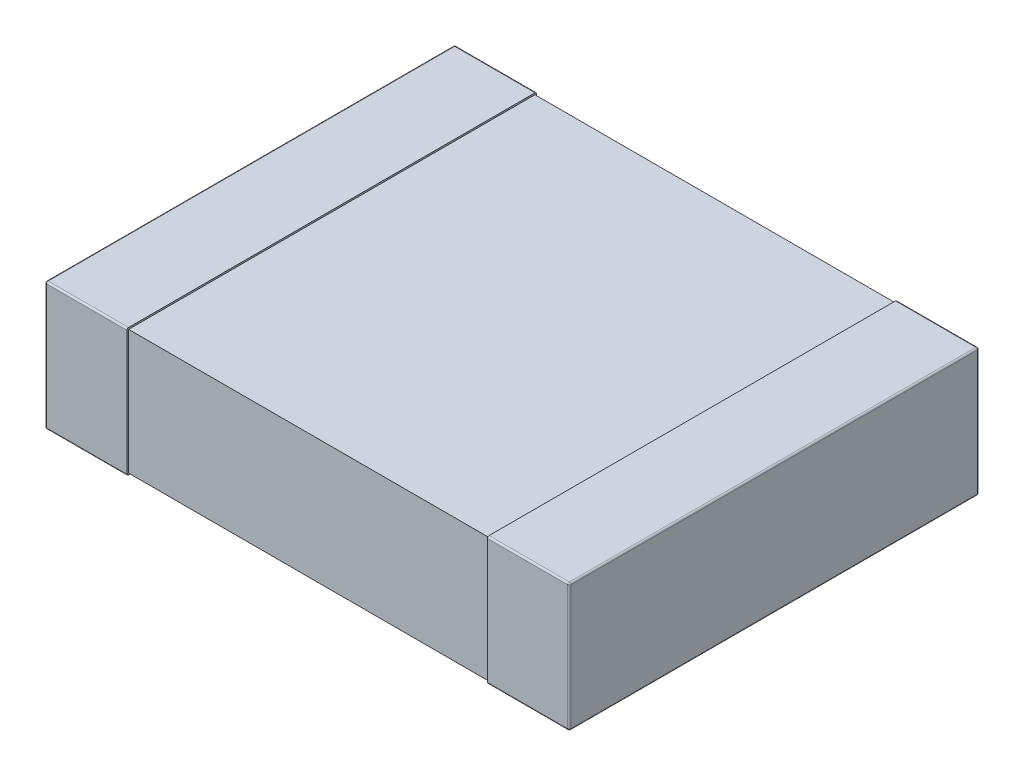
from build123d import *

# Parameters (mm, degrees)
SKETCH1_W            = 0.5
SKETCH1_H            = 2.5
THICKNESS_DEPTH      = 0.39
FILLET1_R            = 0.01
SKETCH2_W            = 2.48
SKETCH2_H            = 0.76
BOSS_EXTRUDE2_DEPTH  = 1.1
FILLET1_OF_MIRROR3_R = 0.01


with BuildPart() as part:
    # Sketch1 → THICKNESS (new, symmetric)
    with BuildSketch(Plane(origin=(0, 0, 0), x_dir=(1, 0, 0), z_dir=(0, 1, 0))):
        with Locations((-1.35, 0)):
            Rectangle(SKETCH1_W, SKETCH1_H)
    thickness = extrude(amount=THICKNESS_DEPTH, both=True)

    # Fillet1
    fillet1_edges = [part.edges().sort_by_distance(p)[0] for p in [
        (-1.35, 0.39, -1.25),
        (-1.6, 0.39, 0),
        (-1.35, -0.39, -1.25),
        (-1.35, -0.39, 1.25),
        (-1.6, -0.39, 0),
        (-1.35, 0.39, 1.25),
        (-1.6, 0, -1.25),
        (-1.6, 0, 1.25),
    ]]
    fillet(fillet1_edges, radius=FILLET1_R)

    # Sketch2 → Boss-Extrude2 (add)
    with BuildSketch(Plane(origin=(0, 0, 0), x_dir=(0, 0, -1), z_dir=(1, 0, 0))):
        Rectangle(SKETCH2_W, SKETCH2_H)
    boss_extrude2 = extrude(amount=-BOSS_EXTRUDE2_DEPTH)

    # Mirror3: THICKNESS, Boss-Extrude2 across plane
    add(thickness.mirror(Plane(origin=(0, 0, 0), x_dir=(0, 0, 1), z_dir=(1, 0, 0))))
    add(boss_extrude2.mirror(Plane(origin=(0, 0, 0), x_dir=(0, 0, 1), z_dir=(1, 0, 0))))

    # Fillet1 of Mirror3
    fillet1_of_mirror3_edges = [part.edges().sort_by_distance(p)[0] for p in [
        (1.35, 0.39, -1.25),
        (1.6, 0.39, 0),
        (1.35, -0.39, -1.25),
        (1.35, -0.39, 1.25),
        (1.6, -0.39, 0),
        (1.35, 0.39, 1.25),
        (1.6, 0, -1.25),
        (1.6, 0, 1.25),
    ]]
    fillet(fillet1_of_mirror3_edges, radius=FILLET1_OF_MIRROR3_R)


solid = part.part
